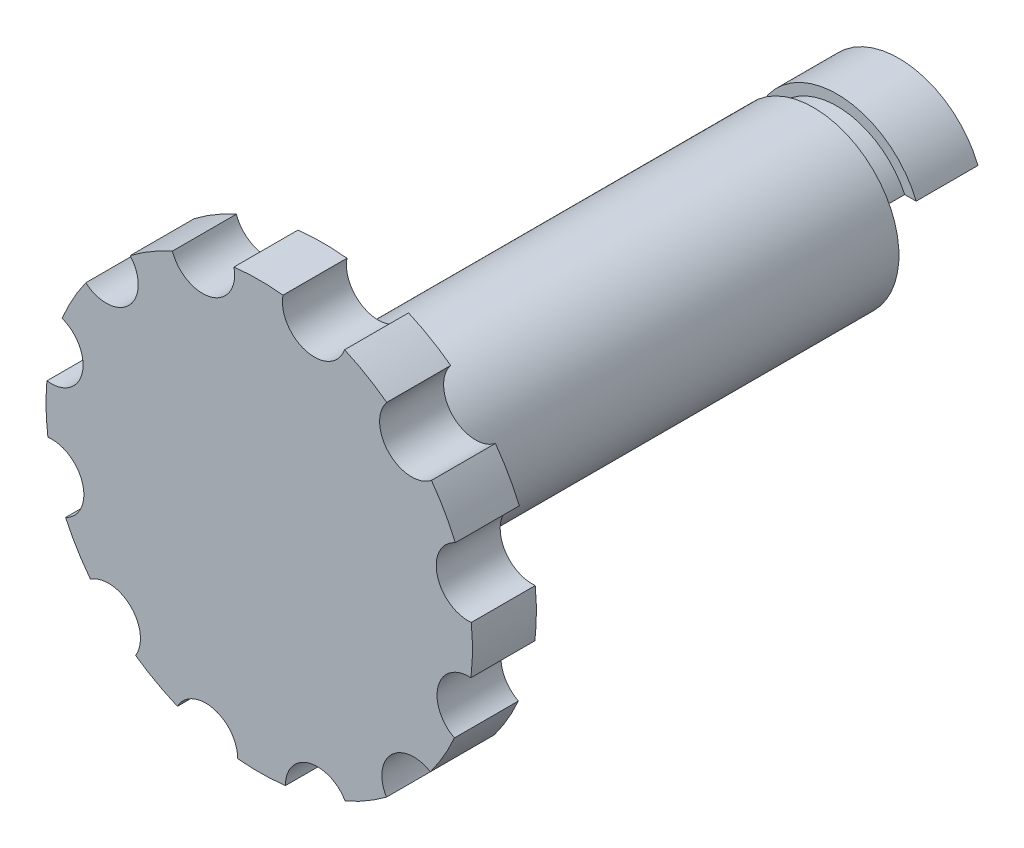
from build123d import *
from build123d.topology import SkipClean

# Parameters (mm, degrees)
SKETCH2_R           = 10
BOSS_EXTRUDE1_DEPTH = 8
SKETCH3_R           = 4
BOSS_EXTRUDE2_DEPTH = 18
BOSS_EXTRUDE3_DEPTH = 4
SKETCH5_R           = 1.5
CUT_EXTRUDE1_DEPTH  = 34.166247904
SKETCH7_R           = 4
CUT_EXTRUDE4_DEPTH  = 5
SKETCH8_W           = 2
SKETCH8_H           = 1.1


with BuildPart() as part:
    # Sketch2 → Boss-Extrude1 (new body)
    with BuildSketch(Plane.XY):
        Circle(SKETCH2_R)
    extrude(amount=BOSS_EXTRUDE1_DEPTH)

    # Sketch3 → Boss-Extrude2 (add)
    with BuildSketch(Plane(origin=(0, 0, 0), x_dir=(-1, 0, 0), z_dir=(0, 0, -1))):
        Circle(SKETCH3_R)
    extrude(amount=BOSS_EXTRUDE2_DEPTH)

    # Sketch4 → Boss-Extrude3 (add)
    with BuildSketch(Plane(origin=(0, 0, -18), x_dir=(-1, 0, 0), z_dir=(0, 0, -1))):
        with BuildLine():
            Line((-3.708099244, 1.5), (3.708099244, 1.5))
            ThreePointArc((3.708099244, 1.5), (0, 4), (-3.708099244, 1.5))
        make_face()
    extrude(amount=BOSS_EXTRUDE3_DEPTH)

    # Sketch5 → Cut-Extrude1 (cut, through all)
    with BuildSketch(Plane.XY.offset(8)):
        with Locations((2.588190451, 9.659258263)):
            Circle(SKETCH5_R)
        with Locations((7.146706221, 7.071620464)):
            Circle(SKETCH5_R)
        with Locations((9.800677781, 2.551402509)):
            Circle(SKETCH5_R)
        with Locations((9.838975596, -2.69020685)):
            Circle(SKETCH5_R)
        with Locations((7.251337797, -7.24872262)):
            Circle(SKETCH5_R)
        with Locations((2.731119842, -9.90269418)):
            Circle(SKETCH5_R)
        with Locations((-2.510489517, -9.940991995)):
            Circle(SKETCH5_R)
        with Locations((-7.069005287, -7.353354196)):
            Circle(SKETCH5_R)
        with Locations((-9.722976847, -2.833136241)):
            Circle(SKETCH5_R)
        with Locations((-9.761274662, 2.408473118)):
            Circle(SKETCH5_R)
        with Locations((-7.173636863, 6.966988887)):
            Circle(SKETCH5_R)
        with Locations((-2.653418908, 9.620960448)):
            Circle(SKETCH5_R)
    extrude(amount=-CUT_EXTRUDE1_DEPTH, mode=Mode.SUBTRACT)

    # Sketch7 → Cut-Extrude4 (cut)
    with SkipClean():  # the faces are left unmerged after this step: merging them gives an invalid solid
        with BuildSketch(Plane(origin=(0, 0, 0), x_dir=(-1, 0, 0), z_dir=(0, 0, -1))):
            with BuildLine():
                ThreePointArc((-9.19759453, 3.924825457), (-8.349060466, 2.173504149), (-9.943847621, 1.058250676))
                ThreePointArc((-9.943847621, 1.058250676), (-9.999770505, -0.067748467), (-9.928596161, -1.192886526))
                ThreePointArc((-9.928596161, -1.192886526), (-8.392085872, -2.294593241), (-9.154279225, -4.024819483))
                ThreePointArc((-9.154279225, -4.024819483), (-8.644955004, -5.026405572), (-8.026480805, -5.964528975))
                ThreePointArc((-8.026480805, -5.964528975), (-6.190486346, -6.188253762), (-5.967423839, -8.024328802))
                ThreePointArc((-5.967423839, -8.024328802), (-5.030319112, -8.642678383), (-4.029806132, -9.152085147))
                ThreePointArc((-4.029806132, -9.152085147), (-2.332315615, -8.45668063), (-1.231269876, -9.923909234))
                ThreePointArc((-1.231269876, -9.923909234), (-0.11108008, -9.999383042), (1.010509904, -9.948812479))
                ThreePointArc((1.010509904, -9.948812479), (2.143211572, -8.486651282), (3.834327269, -9.235688084))
                ThreePointArc((3.834327269, -9.235688084), (4.846248967, -8.747220755), (5.796982612, -8.148312255))
                ThreePointArc((5.796982612, -8.148312255), (6.029458943, -6.27199237), (7.91348406, -6.113654393))
                ThreePointArc((7.91348406, -6.113654393), (8.551343346, -5.184064715), (9.080514936, -4.1885855))
                ThreePointArc((9.080514936, -4.1885855), (8.282868126, -2.413509179), (9.909171595, -1.344737264))
                ThreePointArc((9.909171595, -1.344737264), (9.997729971, -0.213062014), (9.957464452, 0.921358608))
                ThreePointArc((9.957464452, 0.921358608), (8.30494986, 2.049143086), (9.24320622, 3.816168074))
                ThreePointArc((9.24320622, 3.816168074), (8.746443519, 4.847651572), (8.135038438, 5.815595379))
                ThreePointArc((8.135038438, 5.815595379), (6.097591334, 5.921940554), (6.050828458, 7.961625146))
                ThreePointArc((6.050828458, 7.961625146), (5.095196746, 8.604590061), (4.071970326, 9.1334034))
                ThreePointArc((4.071970326, 9.1334034), (2.254614681, 8.174946897), (1.185490282, 9.929482))
                ThreePointArc((1.185490282, 9.929482), (0.035850285, 9.999935738), (-1.114265315, 9.937726742))
                ThreePointArc((-1.114265315, 9.937726742), (-2.199961883, 8.210369523), (-4.003881302, 9.163456472))
                ThreePointArc((-4.003881302, 9.163456472), (-5.025019239, 8.645760906), (-5.980292673, 8.014742638))
                ThreePointArc((-5.980292673, 8.014742638), (-6.080459662, 6.016576258), (-8.077456677, 5.895311156))
                ThreePointArc((-8.077456677, 5.895311156), (-8.693535071, 4.941907322), (-9.19759453, 3.924825457))
            make_face()
            with Locations(Location((0, 0, 0), (0, 0, 157.975687163))):
                Circle(SKETCH7_R, mode=Mode.SUBTRACT)
        extrude(amount=-CUT_EXTRUDE4_DEPTH, mode=Mode.SUBTRACT)

    # Sketch8 → Cut-Revolve2 (revolve, cut)
    with SkipClean():  # the faces are left unmerged after this step: merging them gives an invalid solid
        with BuildSketch(Plane(origin=(0, 0, 0), x_dir=(1, 0, 0), z_dir=(0, 1, 0))):
            with Locations((-4.508099244, 18.55)):
                Rectangle(SKETCH8_W, SKETCH8_H)
        revolve(axis=Axis((0, 0, 0), (0, 0, -1)), mode=Mode.SUBTRACT)


solid = part.part
